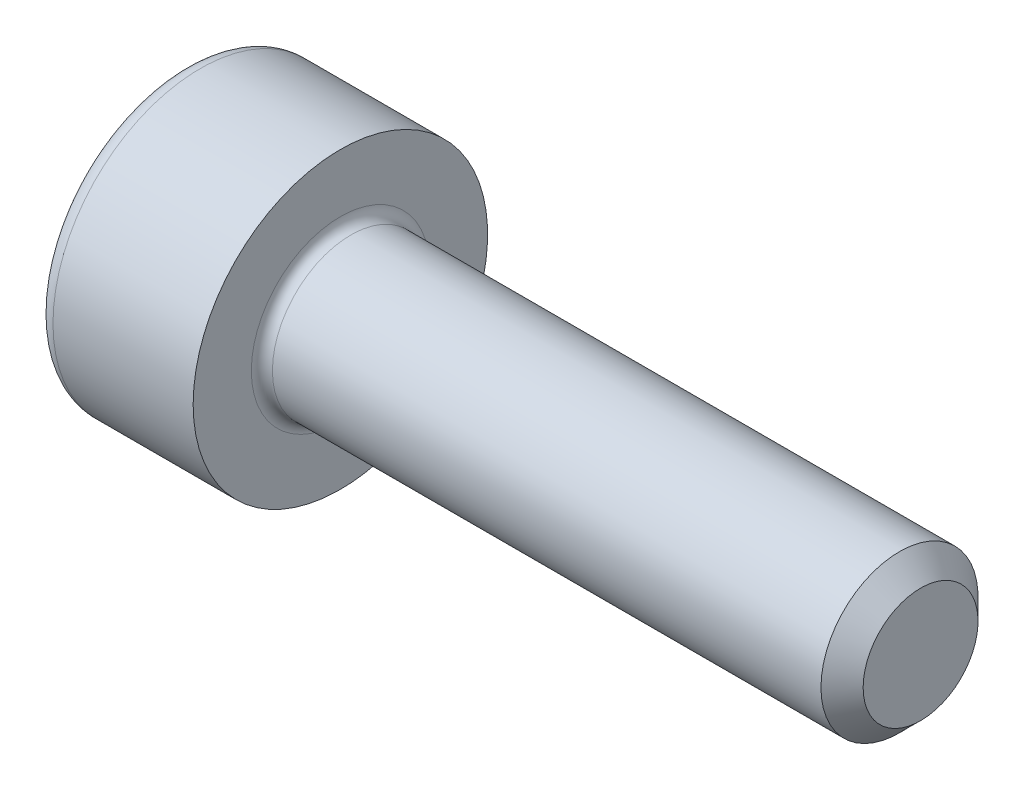
from build123d import *

# Parameters (mm, degrees)
FILLET1_R      = 0.1
FILLET2_R      = 0.16
CHAMFER1_SIZE  = 0.2
EXTRUDE1_DEPTH = 0.7


with BuildPart() as part:
    # Sketch1 → Revolve1 (revolve)
    with BuildSketch(Plane.XY, mode=Mode.PRIVATE) as revolve1_sk:
        Polygon((0, 1.395688245), (0, 0), (6.988734128, 0), (6.988734128, 0.744367064), (1.488734128, 0.744367064), (1.488734128, 1.395688245), align=None)
    revolve(revolve1_sk.sketch.rotate(Axis((0, 0, 0), (1, 0, 0)), 90), axis=Axis((0, 0, 0), (1, 0, 0)))

    # Fillet1
    fillet1_edges = [part.edges().sort_by_distance(p)[0] for p in [
        (1.488734128, 0, -0.744367064),
    ]]
    fillet(fillet1_edges, radius=FILLET1_R)

    # Fillet2
    fillet2_edges = [part.edges().sort_by_distance(p)[0] for p in [
        (0, 0, -1.395688245),
    ]]
    fillet(fillet2_edges, radius=FILLET2_R)

    # Chamfer1
    chamfer1_edges = [part.edges().sort_by_distance(p)[0] for p in [
        (6.988734128, 0, -0.744367064),
    ]]
    chamfer(chamfer1_edges, length=CHAMFER1_SIZE)

    # Sketch2 → Extrude1 (cut)
    with BuildSketch(Plane.ZY):
        Polygon((0, 0.877572409), (-0.76, 0.438786205), (-0.76, -0.438786205), (0, -0.877572409), (0.76, -0.438786205), (0.76, 0.438786205), align=None)
    extrude(amount=-EXTRUDE1_DEPTH, mode=Mode.SUBTRACT)


solid = part.part
